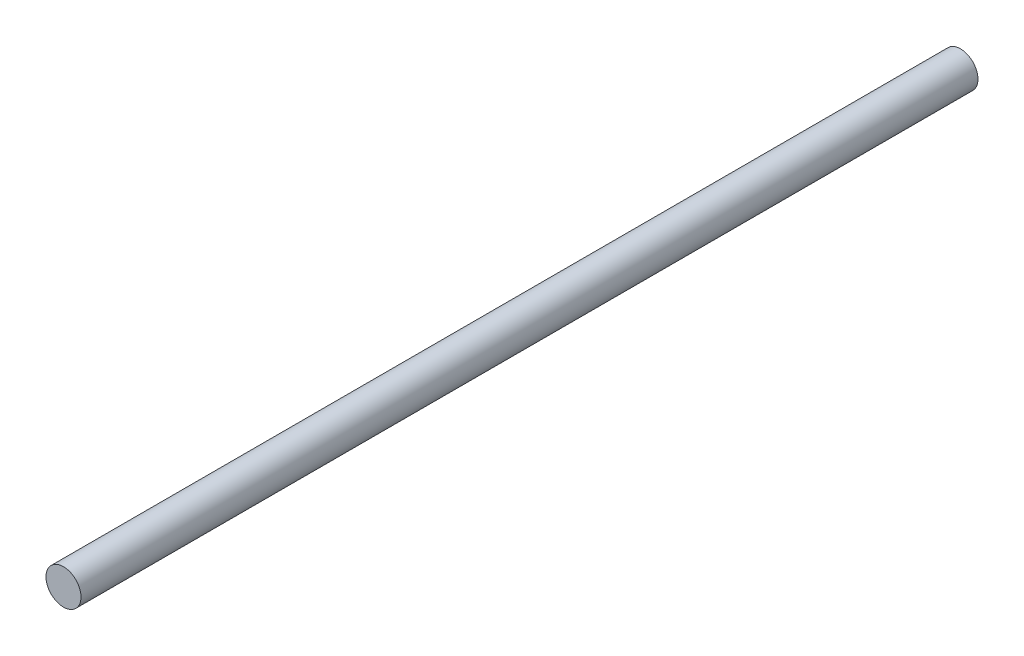
from build123d import *

# Parameters (mm, degrees)
SKETCH1_R           = 3.96875
BOSS_EXTRUDE1_DEPTH = 203.2


with BuildPart() as part:
    # Sketch1 → Boss-Extrude1 (new body)
    with BuildSketch(Plane.XY):
        Circle(SKETCH1_R)
    extrude(amount=BOSS_EXTRUDE1_DEPTH)


solid = part.part
